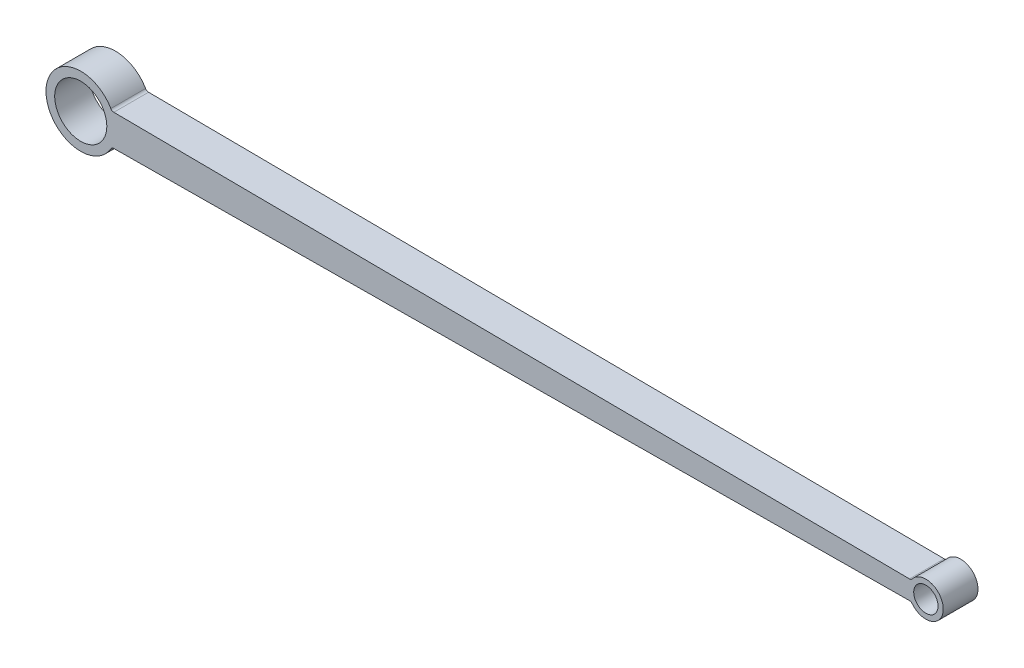
from build123d import *

# Parameters (mm, degrees)
ESBO_O1_R                = 7.5
ESBO_O1_R_2              = 3.5
RESSALTO_EXTRUS_O1_DEPTH = 10


with BuildPart() as part:
    # Esboço1 → Ressalto-extrusão1 (new body)
    with BuildSketch(Plane.XY):
        with BuildLine():
            Line((9.514211155, -4.507297718), (238.473101757, -2.705535542))
            ThreePointArc((238.473101757, -2.705535542), (238.91470232, -2.804462383), (239.267475736, -3.087920483))
            ThreePointArc((239.267475736, -3.087920483), (248.2, 0), (239.267475736, 3.087920483))
            ThreePointArc((239.267475736, 3.087920483), (238.91470232, 2.804462383), (238.473101757, 2.705535542))
            Line((238.473101757, 2.705535542), (9.514211155, 4.507297718))
            ThreePointArc((9.514211155, 4.507297718), (9.019006357, 4.643023372), (8.656436619, 5.006606142))
            ThreePointArc((8.656436619, 5.006606142), (-10, 0), (8.656436619, -5.006606142))
            ThreePointArc((8.656436619, -5.006606142), (9.019006357, -4.643023372), (9.514211155, -4.507297718))
        make_face()
        Circle(ESBO_O1_R, mode=Mode.SUBTRACT)
        with Locations((243.2, 0)):
            Circle(ESBO_O1_R_2, mode=Mode.SUBTRACT)
    extrude(amount=RESSALTO_EXTRUS_O1_DEPTH)


solid = part.part
